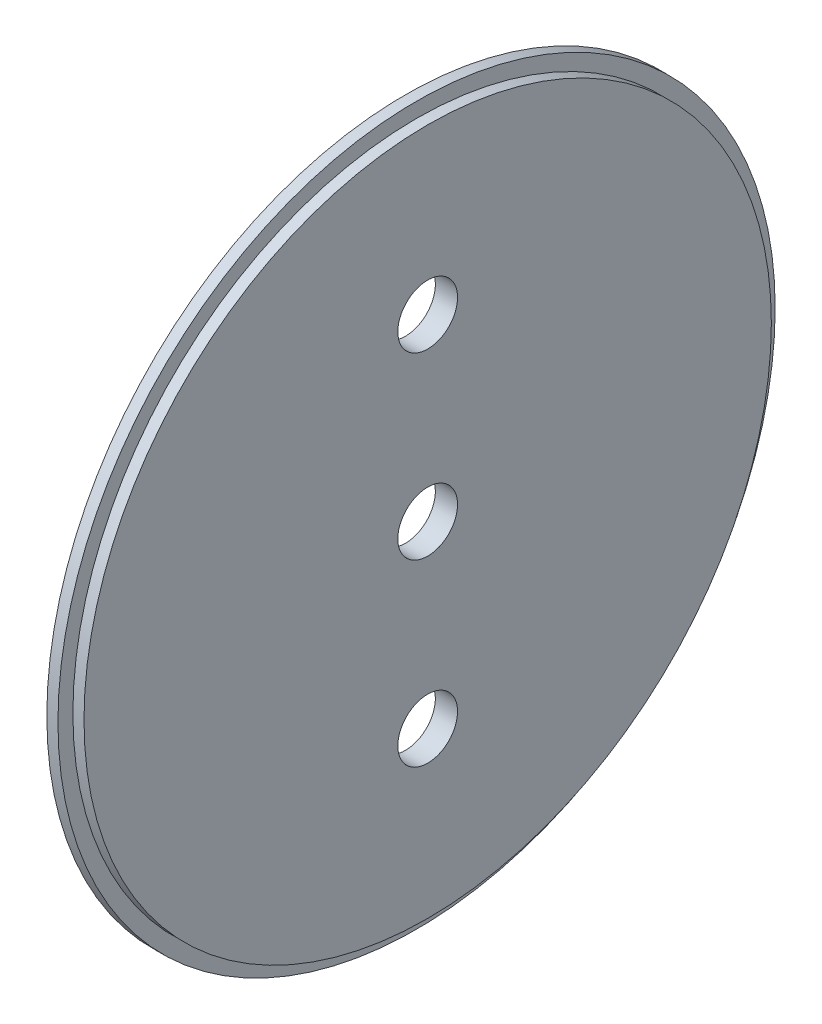
from build123d import *

# Parameters (mm, degrees)
SKETCH1_R           = 38.1
BOSS_EXTRUDE1_DEPTH = 1.1811
SKETCH2_R           = 36.5125
BOSS_EXTRUDE2_DEPTH = 1.1811
SKETCH3_R           = 3.175
CUT_EXTRUDE1_DEPTH  = 54.933292027


with BuildPart() as part:
    # Sketch1 → Boss-Extrude1 (new body)
    with BuildSketch(Plane.YZ):
        with Locations(Location((0, 0, 0), (0, 0, 270))):
            Circle(SKETCH1_R)
    extrude(amount=BOSS_EXTRUDE1_DEPTH)

    # Sketch2 → Boss-Extrude2 (add)
    with BuildSketch(Plane.YZ.offset(1.1811)):
        with Locations(Location((0, 0, 0), (0, 0, 270))):
            Circle(SKETCH2_R)
    extrude(amount=BOSS_EXTRUDE2_DEPTH)

    # Sketch3 → Cut-Extrude1 (cut, through all)
    with BuildSketch(Plane(origin=(0, 0, 0), x_dir=(0, -1, 0), z_dir=(-1, 0, 0))):
        with Locations(Location((19.05, 0, 0), (0, 0, 90))):
            Circle(SKETCH3_R)
        with Locations(Location((-19.05, 0, 0), (0, 0, 90))):
            Circle(SKETCH3_R)
        with Locations(Location((0, 0, 0), (0, 0, 90))):
            Circle(SKETCH3_R)
    extrude(amount=-CUT_EXTRUDE1_DEPTH, mode=Mode.SUBTRACT)


solid = part.part
